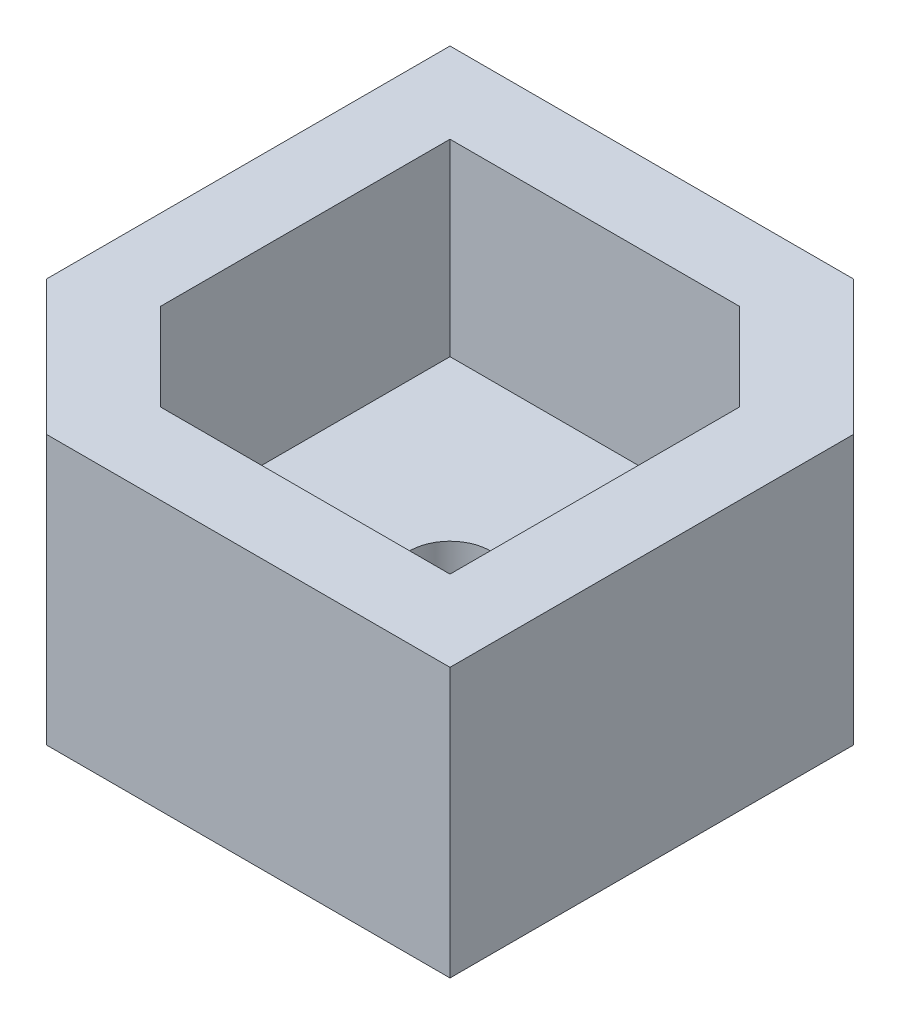
from build123d import *

# Parameters (mm, degrees)
SKETCH_1_W      = 20
SKETCH_1_H      = 20
SKETCH_1_R      = 1.5
EXTRUDE_1_DEPTH = 3
CHAMFER_1_SIZE  = 5
EXTRUDE_2_DEPTH = 7


with BuildPart() as part:
    # 草图1 → 凸台-拉伸1 (new body)
    with BuildSketch(Plane(origin=(0, 0, 0), x_dir=(1, 0, 0), z_dir=(0, 1, 0))):
        Rectangle(SKETCH_1_W, SKETCH_1_H)
        with Locations(Location((0, 0, 0), (0, 0, 270))):
            Circle(SKETCH_1_R, mode=Mode.SUBTRACT)
    extrude(amount=EXTRUDE_1_DEPTH)

    # 倒角1
    chamfer_1_edges = [part.edges().sort_by_distance(p)[0] for p in [
        (-10, 1.5, 10),
        (10, 1.5, -10),
    ]]
    chamfer(chamfer_1_edges, length=CHAMFER_1_SIZE)

    # 草图2 → 凸台-拉伸2 (add)
    with BuildSketch(Plane(origin=(0, 3, 0), x_dir=(1, 0, 0), z_dir=(0, 1, 0))):
        Polygon((10, -10), (10, 5), (5, 10), (-10, 10), (-10, -5), (-5, -10), align=None)
        Polygon((-7, 7), (-7, -3.757359313), (-3.757359313, -7), (7, -7), (7, 3.757359313), (3.757359313, 7), align=None, mode=Mode.SUBTRACT)
    extrude(amount=EXTRUDE_2_DEPTH)


solid = part.part
